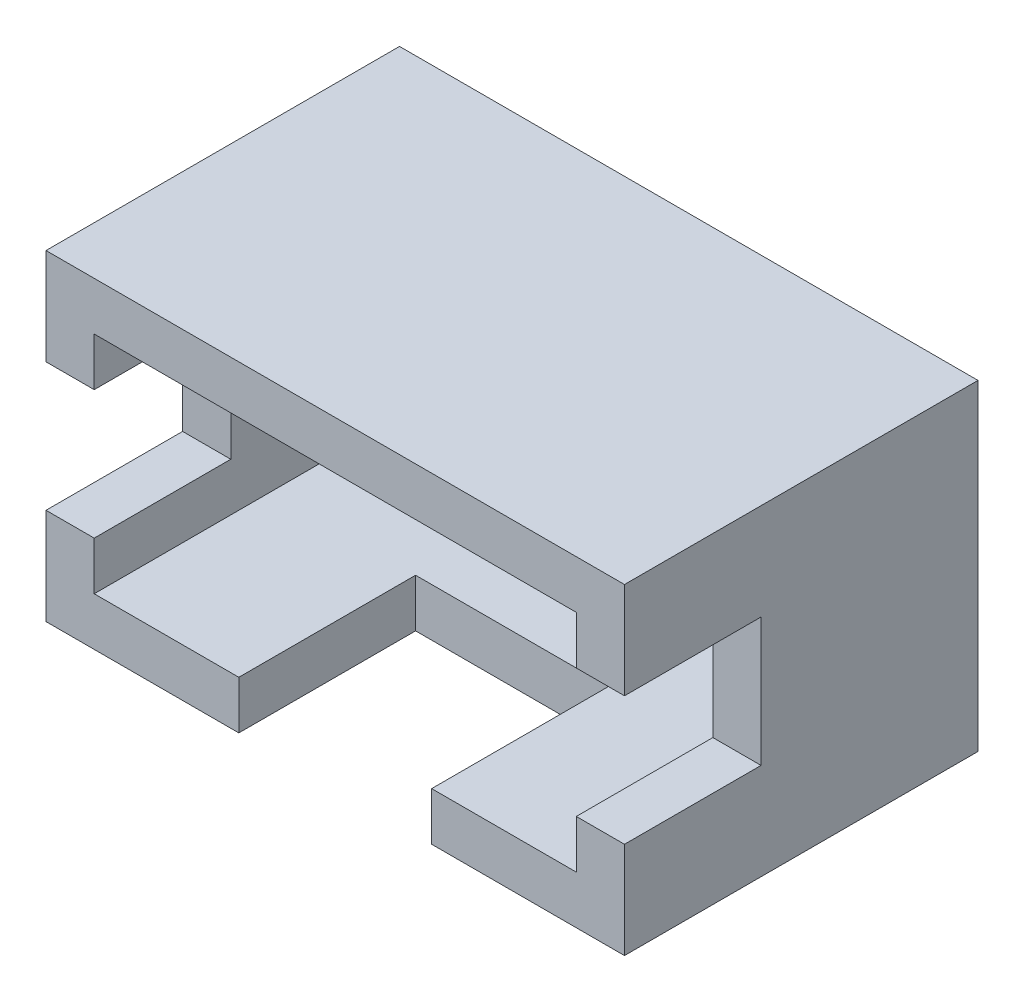
from build123d import *

# Parameters (mm, degrees)
SKETCH_1_W          = 36
SKETCH_1_H          = 20
SKETCH_1_W_2        = 30
SKETCH_1_H_2        = 14
EXTRUDE_2_DEPTH     = 22
SKETCH_2_W          = 9
SKETCH_2_H          = 14
EXTRUDE_3_DEPTH     = 4.5
SKETCH_4_W          = 2
SKETCH_4_H          = 2
EXTRUDE_4_DEPTH     = 2
CUT_EXTRUDE_1_REACH = 46.418
SKETCH_5_W          = 12
SKETCH_5_H          = 11
SKETCH_6_W          = 36
SKETCH_6_H          = 8
CUT_EXTRUDE_2_DEPTH = 8.5


with BuildPart() as part:
    # 스케치1 → 보스-돌출2 (new body)
    with BuildSketch(Plane.XY):
        with Locations((15, 7)):
            Rectangle(SKETCH_1_W, SKETCH_1_H)
        with Locations((15, 7)):
            Rectangle(SKETCH_1_W_2, SKETCH_1_H_2, mode=Mode.SUBTRACT)
    extrude(amount=EXTRUDE_2_DEPTH)

    # 스케치2 → 보스-돌출3 (add)
    with BuildSketch(Plane(origin=(0, 0, 0), x_dir=(-1, 0, 0), z_dir=(0, 0, -1))):
        with Locations((-15.5, 7)):
            Rectangle(SKETCH_2_W, SKETCH_2_H)
    extrude(amount=-EXTRUDE_3_DEPTH)

    # 스케치4 → 보스-돌출4 (add)
    with BuildSketch(Plane(origin=(0, 0, 0), x_dir=(-1, 0, 0), z_dir=(0, 0, -1))):
        with Locations((-15, -4)):
            Rectangle(SKETCH_4_W, SKETCH_4_H)
    extrude(amount=-EXTRUDE_4_DEPTH)

    # 스케치5 → 컷-돌출1 (cut, up to next)
    with BuildSketch(Plane.XZ.offset(3), mode=Mode.PRIVATE) as cut_extrude_1_sk1:
        with Locations((15, 16.5)):
            Rectangle(SKETCH_5_W, SKETCH_5_H)
    cut_extrude_1_tool1 = extrude(cut_extrude_1_sk1.sketch, amount=-CUT_EXTRUDE_1_REACH, mode=Mode.PRIVATE) & part.part
    add(cut_extrude_1_tool1.solids().sort_by_distance((15, -3, 16.5))[0], mode=Mode.SUBTRACT)

    # 스케치6 → 컷-돌출2 (cut)
    with BuildSketch(Plane.XY.offset(22)):
        with Locations((15, 7)):
            Rectangle(SKETCH_6_W, SKETCH_6_H)
    extrude(amount=-CUT_EXTRUDE_2_DEPTH, mode=Mode.SUBTRACT)


solid = part.part
